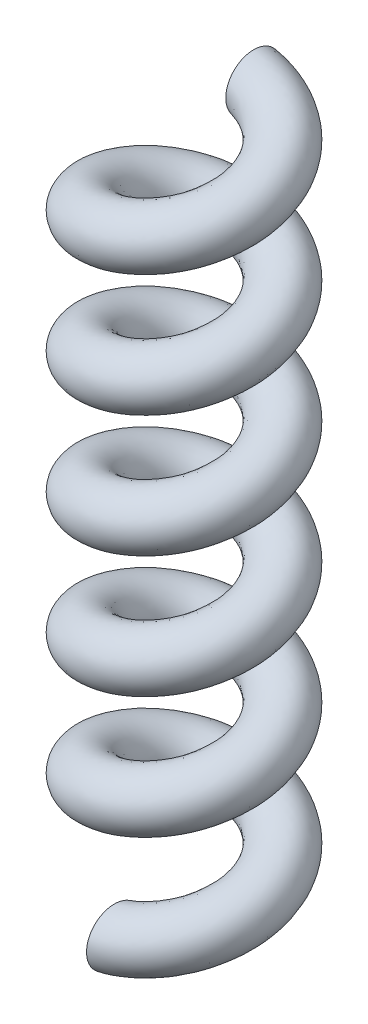
from build123d import *

# Parameters (mm, degrees)
BALAYAGE2_PITCH  = 1.75
BALAYAGE2_HEIGHT = 9.625
BALAYAGE2_RADIUS = 1
ESQUISSE28_R     = 0.4


with BuildPart() as part:
    # Balayage2: sweep along a helix
    with BuildLine() as balayage2_path:
        Helix(BALAYAGE2_PITCH, BALAYAGE2_HEIGHT, BALAYAGE2_RADIUS, center=(0, 0, 0), direction=(0, 1, 0))
    # Esquisse28 → Balayage2 (sweep)
    with BuildSketch(Plane(origin=(0, 0, 0), x_dir=(0, 0, -1), z_dir=(1, 0, 0))):
        with Locations((-1, 0)):
            Circle(ESQUISSE28_R)
    sweep(path=balayage2_path.line, is_frenet=True)


solid = part.part
